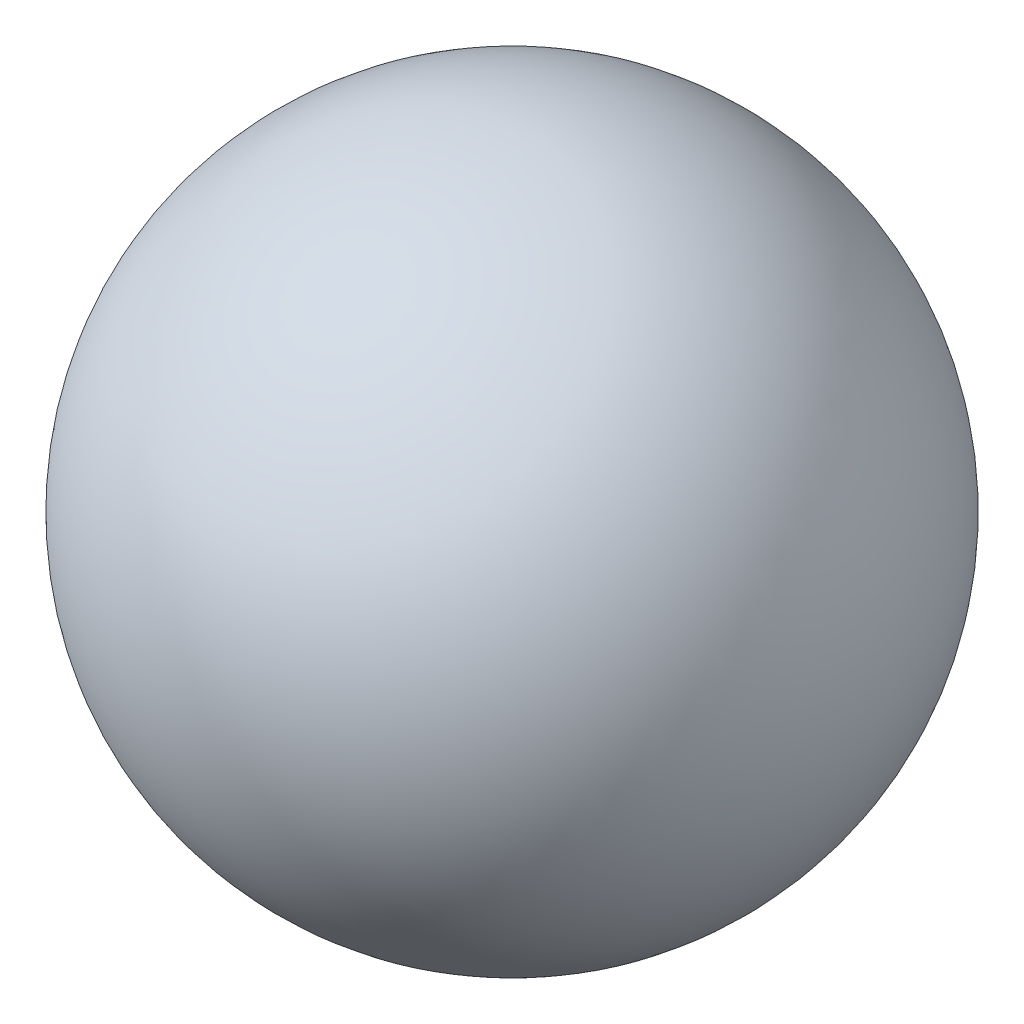
from build123d import *


with BuildPart() as part:
    # Sketch1 → Revolve1 (revolve)
    with BuildSketch(Plane.XY):
        with BuildLine():
            Line((0, 6.35), (0, -6.35))
            ThreePointArc((0, -6.35), (6.35, 0), (0, 6.35))
        make_face()
    revolve(axis=Axis((0, 6.35, 0), (0, -1, 0)))


solid = part.part
